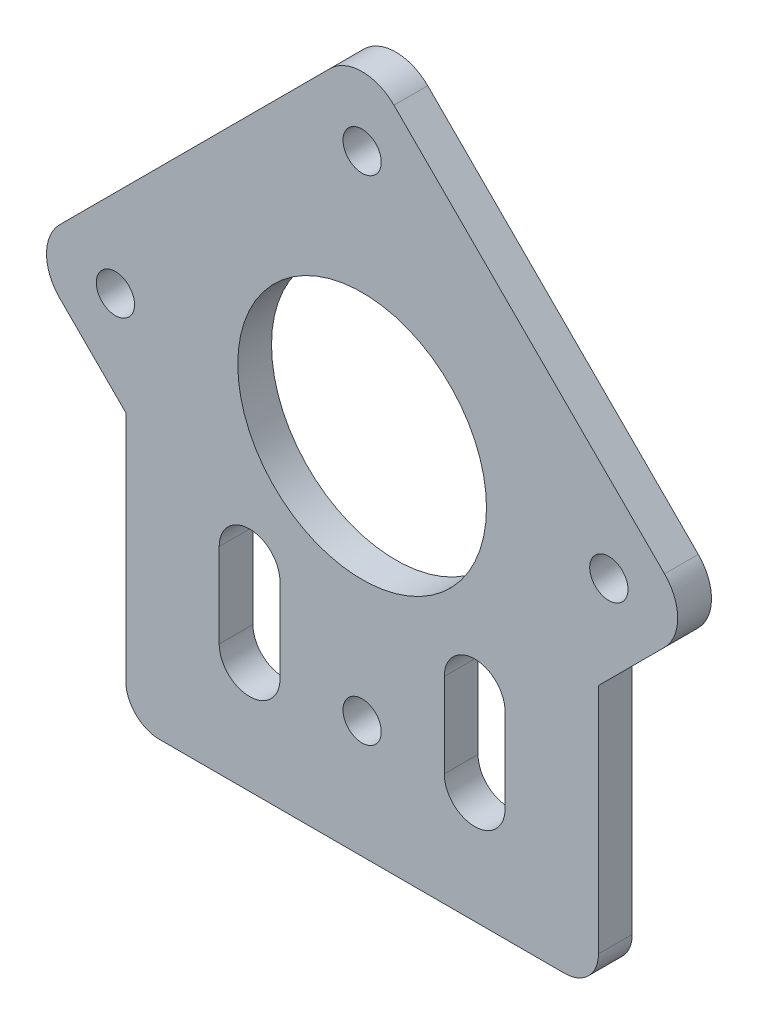
from build123d import *

# Parameters (mm, degrees)
MODEL_R                         = 1.7
MODEL_R_2                       = 11.05
AUFSATZ_LINEAR_AUSTRAGEN1_DEPTH = 3


with BuildPart() as part:
    # Model → Aufsatz-Linear austragen1 (new body)
    with BuildSketch(Plane.XY):
        with BuildLine():
            Line((51, 3), (51, 23.65151519))
            Line((51, 23.65151519), (56.870057685, 29.521572875))
            ThreePointArc((56.870057685, 29.521572875), (58.04163056, 32.35), (56.870057685, 35.178427125))
            Line((56.870057685, 35.178427125), (32.828427125, 59.220057685))
            ThreePointArc((32.828427125, 59.220057685), (30, 60.39163056), (27.171572875, 59.220057685))
            Line((27.171572875, 59.220057685), (3.129942315, 35.178427125))
            ThreePointArc((3.129942315, 35.178427125), (1.95836944, 32.35), (3.129942315, 29.521572875))
            Line((3.129942315, 29.521572875), (9, 23.65151519))
            Line((9, 23.65151519), (9, 3))
            ThreePointArc((9, 3), (9.878679656, 0.878679656), (12, 0))
            Line((12, 0), (48, 0))
            ThreePointArc((48, 0), (50.121320344, 0.878679656), (51, 3))
        make_face()
        with Locations((30, 10.429689783)):
            Circle(MODEL_R, mode=Mode.SUBTRACT)
        with Locations((51.920310217, 32.35)):
            Circle(MODEL_R, mode=Mode.SUBTRACT)
        with Locations((30, 54.270310217)):
            Circle(MODEL_R, mode=Mode.SUBTRACT)
        with Locations((8.079689783, 32.35)):
            Circle(MODEL_R, mode=Mode.SUBTRACT)
        with Locations((30, 32.35)):
            Circle(MODEL_R_2, mode=Mode.SUBTRACT)
        with BuildLine():
            Line((22.7, 10), (22.7, 17.5))
            ThreePointArc((22.7, 17.5), (20, 20.2), (17.3, 17.5))
            Line((17.3, 17.5), (17.3, 10))
            ThreePointArc((17.3, 10), (20, 7.3), (22.7, 10))
        make_face(mode=Mode.SUBTRACT)
        with BuildLine():
            Line((37.3, 10), (37.3, 17.5))
            ThreePointArc((37.3, 17.5), (40, 20.2), (42.7, 17.5))
            Line((42.7, 17.5), (42.7, 10))
            ThreePointArc((42.7, 10), (40, 7.3), (37.3, 10))
        make_face(mode=Mode.SUBTRACT)
    extrude(amount=AUFSATZ_LINEAR_AUSTRAGEN1_DEPTH)


solid = part.part
